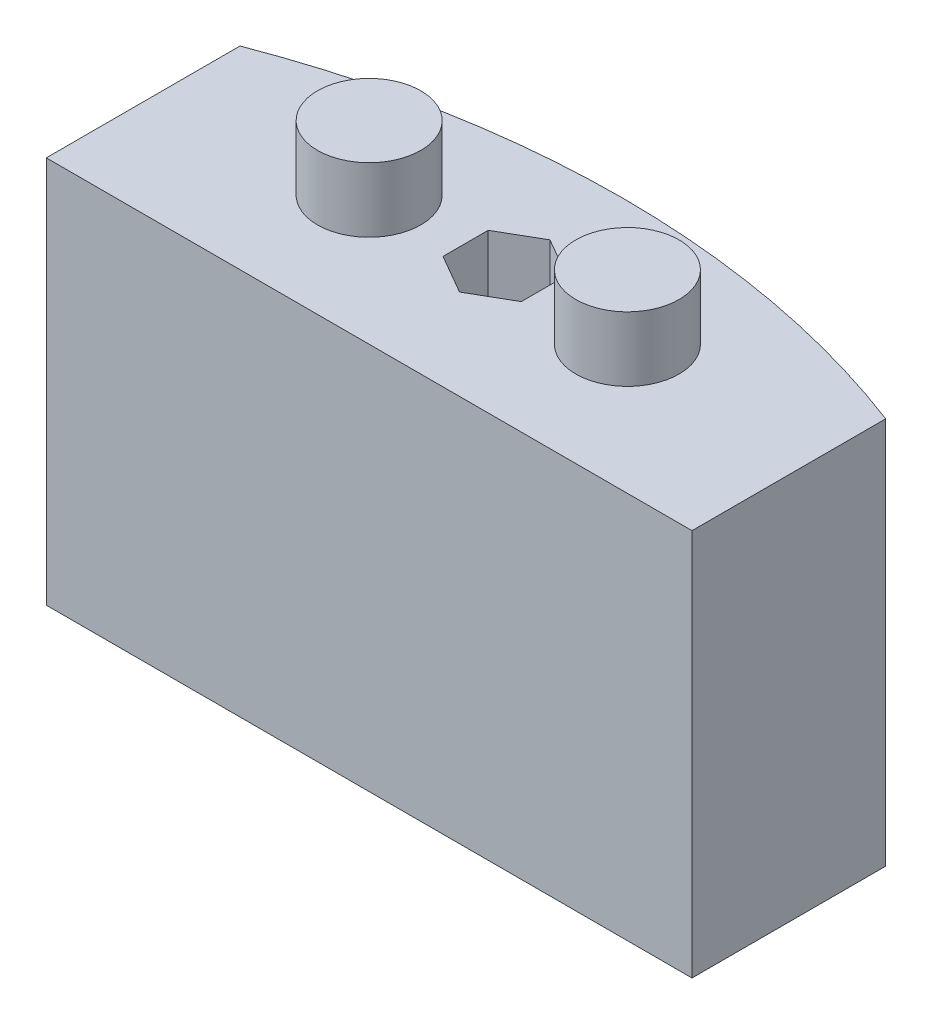
from build123d import *

# Parameters (mm, degrees)
BOSS_EXTRUDE1_DEPTH = 30
SKETCH2_R           = 4
BOSS_EXTRUDE2_DEPTH = 5
CUT_EXTRUDE1_DEPTH  = 27
SKETCH4_R           = 1.25
CUT_EXTRUDE2_DEPTH  = 10


with BuildPart() as part:
    # Sketch1 → Boss-Extrude1 (new body)
    with BuildSketch(Plane(origin=(0, 0, 0), x_dir=(1, 0, 0), z_dir=(0, 1, 0))):
        with BuildLine():
            Line((-25, 15), (-25, 0))
            Line((-25, 0), (25, 0))
            Line((25, 0), (25, 15))
            ThreePointArc((25, 15), (0, 19.616515847), (-25, 15))
        make_face()
    extrude(amount=BOSS_EXTRUDE1_DEPTH)

    # Sketch2 → Boss-Extrude2 (add)
    with BuildSketch(Plane(origin=(0, 30, 0), x_dir=(1, 0, 0), z_dir=(0, 1, 0))):
        with Locations(Location((-10, 10, 0), (0, 0, 270))):
            Circle(SKETCH2_R)
        with Locations(Location((10, 10, 0), (0, 0, 270))):
            Circle(SKETCH2_R)
    extrude(amount=BOSS_EXTRUDE2_DEPTH)

    # Sketch3 → Cut-Extrude1 (cut)
    with BuildSketch(Plane.XZ.offset(-30)):
        Polygon((0, -7), (-3.031088913, -8.75), (-3.031088913, -12.25), (0, -14), (3.031088913, -12.25), (3.031088913, -8.75), align=None)
    extrude(amount=CUT_EXTRUDE1_DEPTH, mode=Mode.SUBTRACT)

    # Sketch4 → Cut-Extrude2 (cut)
    with BuildSketch(Plane.XZ):
        with Locations(Location((0, -10.5, 0), (0, 0, 270))):
            Circle(SKETCH4_R)
    extrude(amount=-CUT_EXTRUDE2_DEPTH, mode=Mode.SUBTRACT)


solid = part.part
